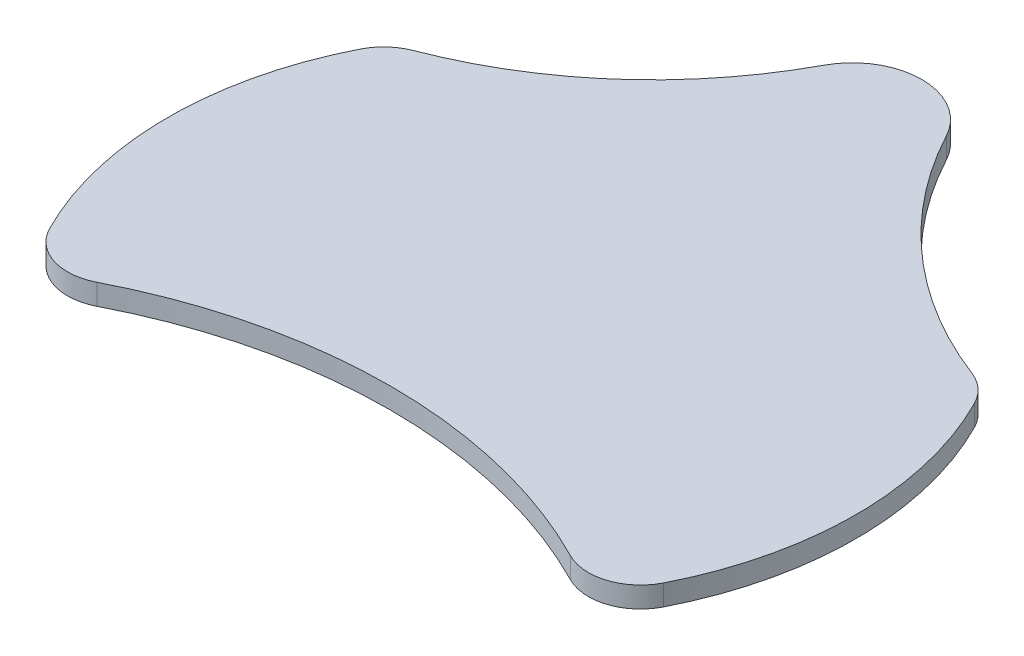
from build123d import *

# Parameters (mm, degrees)
BOSS_EXTRUDE1_DEPTH = 3


with BuildPart() as part:
    # Sketch1 → Boss-Extrude1 (new body)
    with BuildSketch(Plane(origin=(0, 0, 0), x_dir=(1, 0, 0), z_dir=(0, 1, 0))):
        with BuildLine():
            ThreePointArc((-44.190268387, -41.389735818), (-39.823508359, -45.131010371), (-34.090908396, -44.680426216))
            ThreePointArc((-34.090908396, -44.680426216), (-7.1e-08, -36.484692283), (34.090908269, -44.680426152))
            ThreePointArc((34.090908269, -44.680426152), (39.823508354, -45.131010372), (44.190268446, -41.389735701))
            ThreePointArc((44.190268446, -41.389735701), (49.538672672, -18.999999828), (44.19026829, 3.389736008))
            ThreePointArc((44.19026829, 3.389736008), (42.526729152, 5.566147144), (40.192590574, 6.999996857))
            ThreePointArc((40.192590574, 6.999996857), (22.010436955, 18.032282207), (8.819043592, 34.714283628))
            ThreePointArc((8.819043592, 34.714283628), (7.4e-08, 40), (-8.819043522, 34.714283759))
            ThreePointArc((-8.819043522, 34.714283759), (-22.010436745, 18.032282393), (-40.19259019, 6.999997005))
            ThreePointArc((-40.19259019, 6.999997005), (-42.526728969, 5.566147309), (-44.190268254, 3.389736081))
            ThreePointArc((-44.190268254, 3.389736081), (-49.538672672, -18.999999853), (-44.190268387, -41.389735818))
        make_face()
    extrude(amount=BOSS_EXTRUDE1_DEPTH)


solid = part.part
